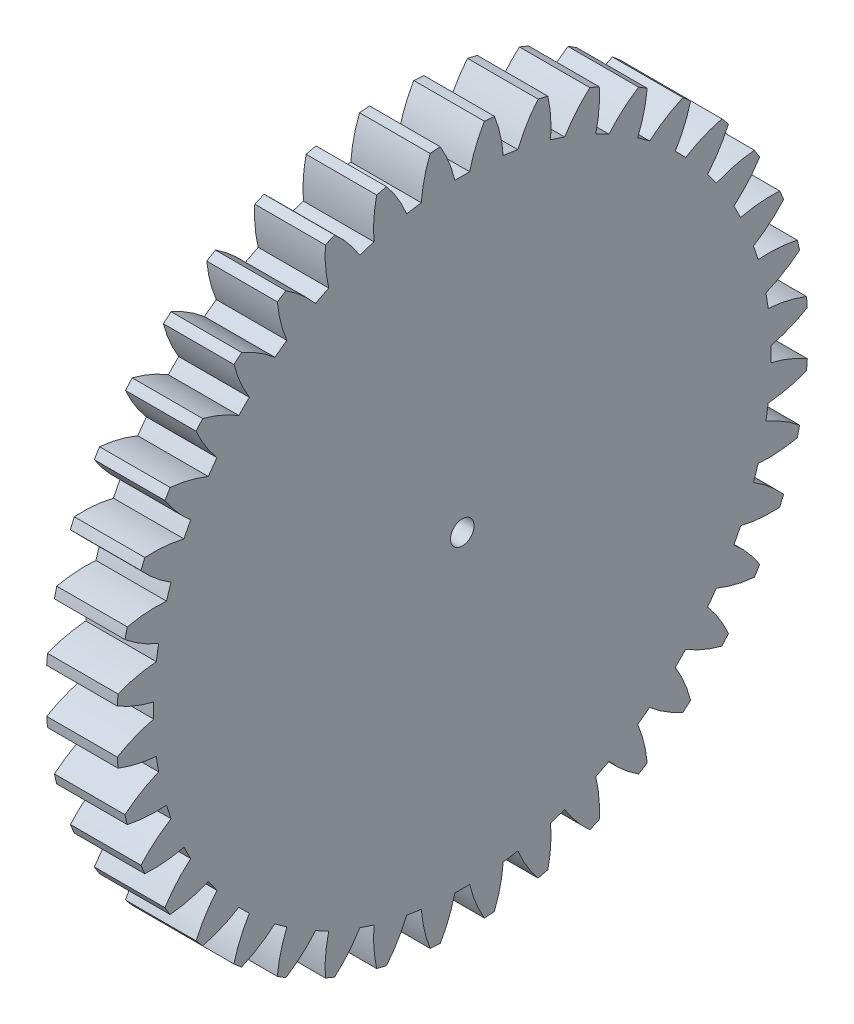
from build123d import *

# Parameters (mm, degrees)
BASPROSKE_W     = 3
BASPROSKE_H     = 14.7
TOOTHCUT_DEPTH  = 22.004285277
TEETHCUTS_COUNT = 40
TEETHCUTS_ANGLE = 351
BORSKE_R        = 0.5
BORE_DEPTH      = 50.0000508


with BuildPart() as part:
    # BasProSke → Base-Revolve (revolve)
    with BuildSketch(Plane(origin=(0, 0, 0), x_dir=(1, 0, 0), z_dir=(0, 1, 0)), mode=Mode.PRIVATE) as base_revolve_sk:
        with Locations((1.5, 7.35)):
            Rectangle(BASPROSKE_W, BASPROSKE_H)
    revolve(base_revolve_sk.sketch.rotate(Axis((-10, 0, 0), (1, 0, 0)), 180), axis=Axis((-10, 0, 0), (1, 0, 0)))

    # TooCutSke → ToothCut (cut, through all)
    with BuildSketch(Plane(origin=(0, 0, 0), x_dir=(0, 0, -1), z_dir=(1, 0, 0))):
        with BuildLine():
            ThreePointArc((0.314656861, 13.120227401), (0, 13.124), (-0.314656861, 13.120227401))
            ThreePointArc((-0.314656861, 13.120227401), (-0.57399718, 13.93172943), (-0.953433546, 14.69450134))
            ThreePointArc((-0.953433546, 14.69450134), (0, 14.7254), (0.953433546, 14.69450134))
            ThreePointArc((0.953433546, 14.69450134), (0.57399718, 13.93172943), (0.314656861, 13.120227401))
        make_face()
    toothcut = extrude(amount=TOOTHCUT_DEPTH, mode=Mode.SUBTRACT)

    # TeethCuts: ToothCut ×40 about axis
    teethcuts_axis = Axis((-10, 0, 0), (1, 0, 0))
    for i in range(1, TEETHCUTS_COUNT):
        add(toothcut.rotate(teethcuts_axis, i * TEETHCUTS_ANGLE / (TEETHCUTS_COUNT - 1)), mode=Mode.SUBTRACT)

    # BorSke → Bore (cut, symmetric)
    with BuildSketch(Plane(origin=(0, 0, 0), x_dir=(0, 0, -1), z_dir=(1, 0, 0))):
        with Locations(Location((0, 0, 0), (0, 0, 180))):
            Circle(BORSKE_R)
    extrude(amount=BORE_DEPTH, both=True, mode=Mode.SUBTRACT)


solid = part.part
